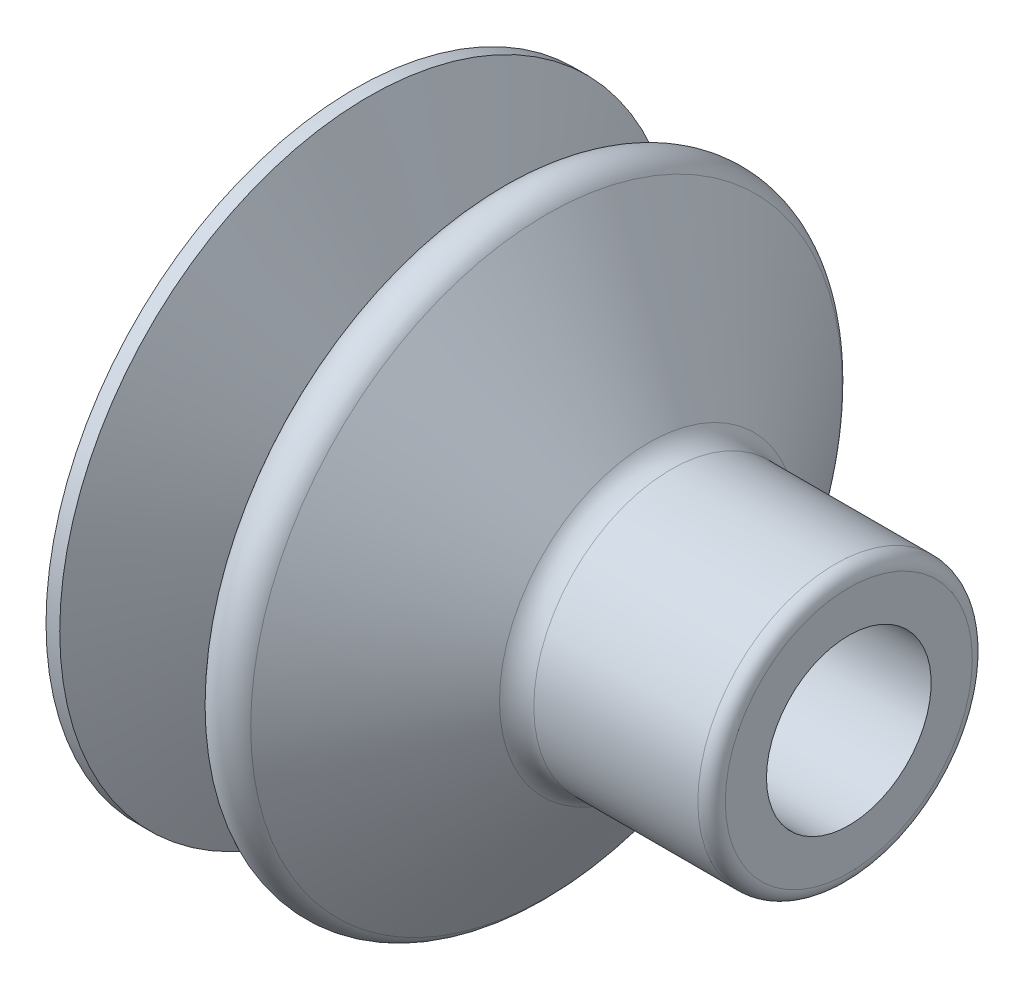
from build123d import *

# Parameters (mm, degrees)
SKETCH_1_W = 7
SKETCH_1_H = 2
FILLET_1_R = 1
FILLET_2_R = 1
FILLET_3_R = 0.5
FILLET_4_R = 0.5
FILLET_5_R = 0.5


with BuildPart() as part:
    # Эскиз1 → Повернуть1 (revolve)
    with BuildSketch(Plane.XY, mode=Mode.PRIVATE) as revolve_1_sk:
        Polygon((0, 11.25), (0, 11.13953373), (2.680178173, 5.37), (3.317019891, 5.37), (5.765043922, 10.530887802), (11, 3), (11, 5), (6, 12.192885374), (3, 5.868330053), (0.5, 11.25), align=None)
        with Locations((14.5, 4)):
            Rectangle(SKETCH_1_W, SKETCH_1_H)
    revolve(revolve_1_sk.sketch.rotate(Axis((0, 0, 0), (1, 0, 0)), 90), axis=Axis((0, 0, 0), (1, 0, 0)))

    # Скругление1
    fillet_1_edges = [part.edges().sort_by_distance(p)[0] for p in [
        (6, 0, -12.192885374),
    ]]
    fillet(fillet_1_edges, radius=FILLET_1_R)

    # Скругление2
    fillet_2_edges = [part.edges().sort_by_distance(p)[0] for p in [
        (11, 0, -5),
    ]]
    fillet(fillet_2_edges, radius=FILLET_2_R)

    # Скругление3
    fillet_3_edges = [part.edges().sort_by_distance(p)[0] for p in [
        (3, 0, -5.868330053),
    ]]
    fillet(fillet_3_edges, radius=FILLET_3_R)

    # Скругление4
    fillet_4_edges = [part.edges().sort_by_distance(p)[0] for p in [
        (3.317019891, 0, -5.37),
        (2.680178173, 0, -5.37),
    ]]
    fillet(fillet_4_edges, radius=FILLET_4_R)

    # Скругление5
    fillet_5_edges = [part.edges().sort_by_distance(p)[0] for p in [
        (18, 0, -5),
    ]]
    fillet(fillet_5_edges, radius=FILLET_5_R)


solid = part.part
